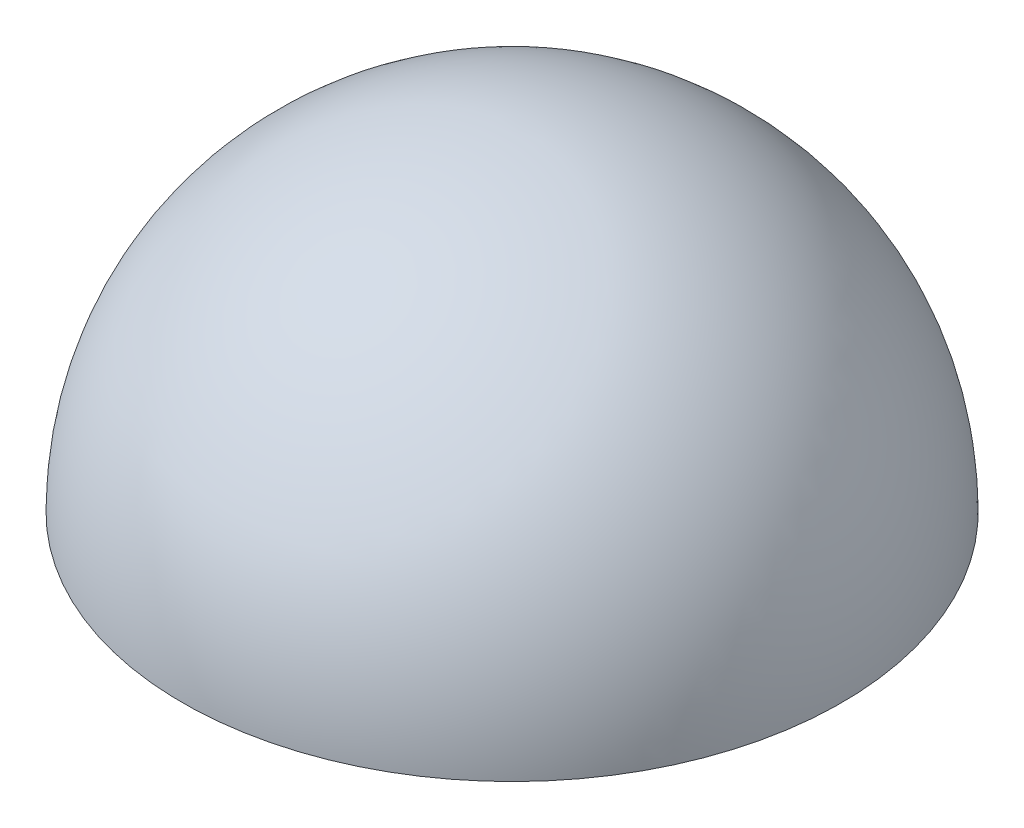
from build123d import *

# Parameters (mm, degrees)
REVOLVE1_ANGLE      = 180
SHELL2_T            = -1.2
SKETCH4_W           = 16.30613237
SKETCH4_H           = 1.2
SKETCH4_W_2         = 16.004639453
SKETCH4_W_3         = 1.2
SKETCH4_H_2         = 16.004639453
BOSS_EXTRUDE1_DEPTH = 1
SKETCH5_W           = 1.2
SKETCH5_H           = 1
SKETCH5_W_2         = 1
SKETCH5_H_2         = 1.2
BOSS_EXTRUDE2_DEPTH = 5


with BuildPart() as part:
    # Sketch3 → Revolve1 (revolve)
    with BuildSketch(Plane(origin=(0, 0, 0), x_dir=(1, 0, 0), z_dir=(0, 1, 0))):
        with BuildLine():
            Line((-40, 0), (40, 0))
            ThreePointArc((40, 0), (0, 40), (-40, 0))
        make_face()
    revolve(axis=Axis((-40, 0, 0), (1, 0, 0)), revolution_arc=REVOLVE1_ANGLE)

    # Shell2
    shell2_openings = [part.faces().sort_by_distance(p)[0] for p in [
        (0, 0, 0),
    ]]
    offset(amount=SHELL2_T, openings=shell2_openings)

    # Sketch4 → Boss-Extrude1 (add)
    with BuildSketch(Plane.XZ):
        with Locations((-31.248426732, 0)):
            Rectangle(SKETCH4_W, SKETCH4_H)
        with Locations((31.097680274, 0)):
            Rectangle(SKETCH4_W_2, SKETCH4_H)
        with Locations((0, -31.097680274)):
            Rectangle(SKETCH4_W_3, SKETCH4_H_2)
        with Locations((0, 31.097680274)):
            Rectangle(SKETCH4_W_3, SKETCH4_H_2)
    extrude(amount=-BOSS_EXTRUDE1_DEPTH)

    # Sketch5 → Boss-Extrude2 (add)
    with BuildSketch(Plane.XZ):
        with Locations((0, 23.595360547)):
            Rectangle(SKETCH5_W, SKETCH5_H)
        with Locations((-23.595360547, 0)):
            Rectangle(SKETCH5_W_2, SKETCH5_H_2)
        with Locations((23.595360547, 0)):
            Rectangle(SKETCH5_W_2, SKETCH5_H_2)
        with Locations((0, -23.595360547)):
            Rectangle(SKETCH5_W, SKETCH5_H)
    extrude(amount=BOSS_EXTRUDE2_DEPTH)


solid = part.part
